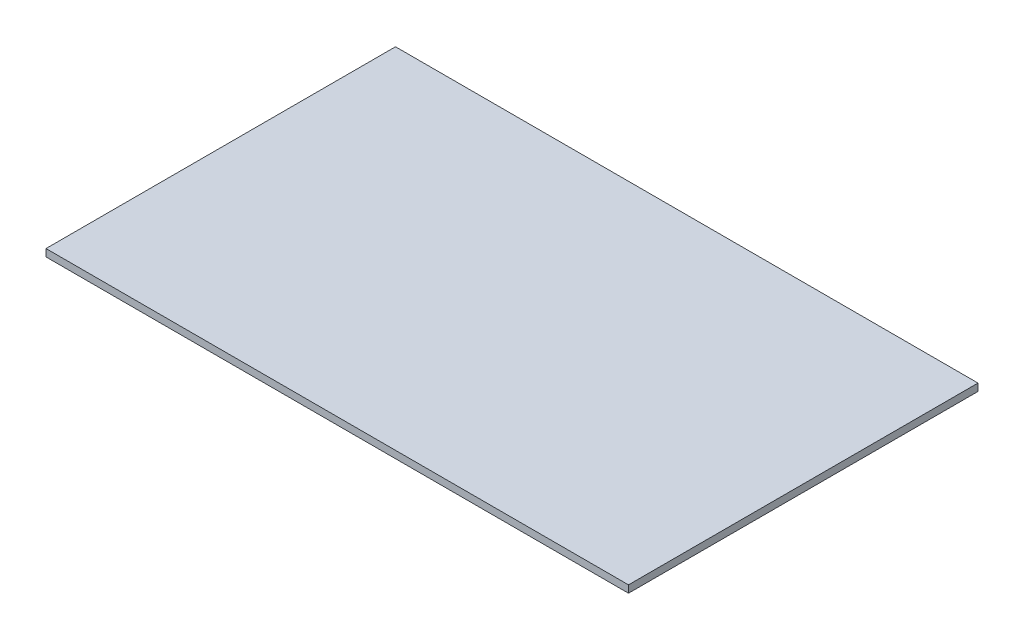
from build123d import *

# Parameters (mm, degrees)
SKETCH1_W           = 127
SKETCH1_H           = 76.2
BOSS_EXTRUDE1_DEPTH = 1.5875


with BuildPart() as part:
    # Sketch1 → Boss-Extrude1 (new body)
    with BuildSketch(Plane(origin=(0, 0, 0), x_dir=(1, 0, 0), z_dir=(0, 1, 0))):
        with Locations((12.013513514, -1.487387387)):
            Rectangle(SKETCH1_W, SKETCH1_H)
    extrude(amount=BOSS_EXTRUDE1_DEPTH)


solid = part.part
